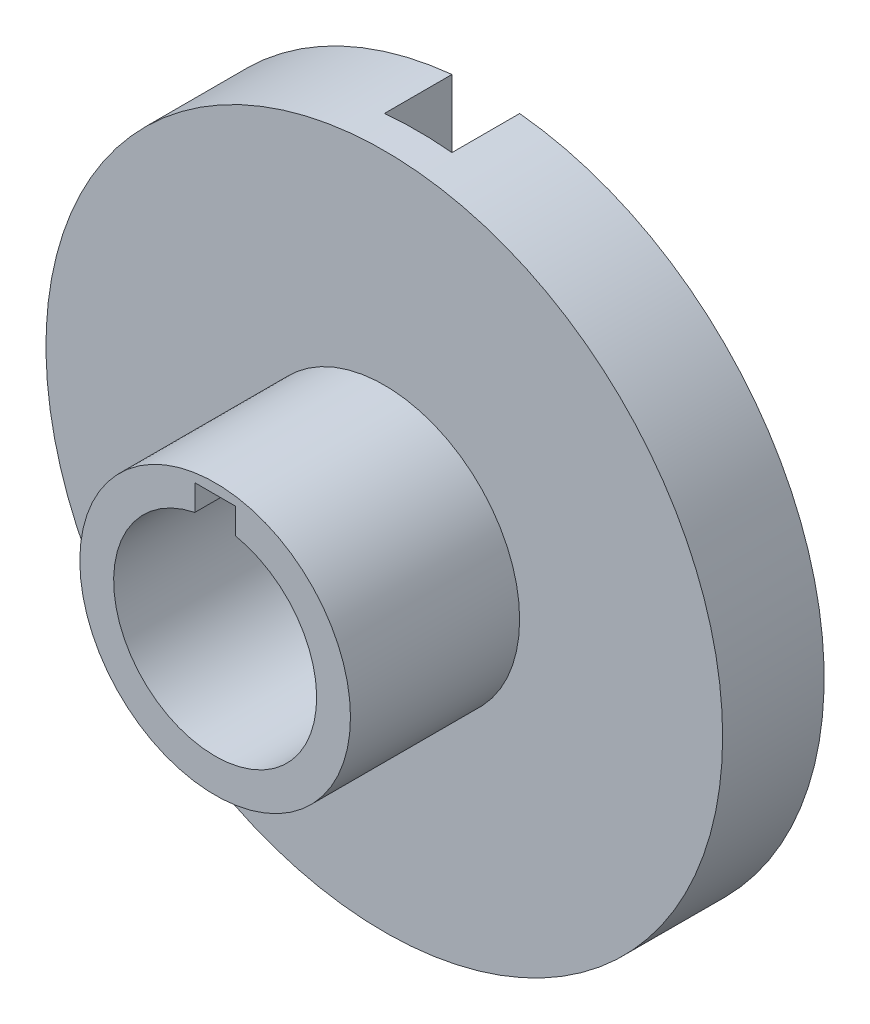
from build123d import *

# Parameters (mm, degrees)
SKETCH1_R               = 50
SKETCH1_R_2             = 20
BOSS_EXTRUDE1_DEPTH     = 15
SKETCH1_3_R             = 20
SKETCH1_3_R_2           = 15
BOSS_EXTRUDE2_DEPTH     = 40
SKETCH2_W               = 6
SKETCH2_H               = 4
CUT_EXTRUDE1_DEPTH      = 80
CUT_EXTRUDE2_DEPTH      = 80
CUT_EXTRUDE2_DEPTH_BACK = 80
SKETCH3_W               = 10
SKETCH3_H               = 10


with BuildPart() as part:
    # Sketch1 → Boss-Extrude1 (new body)
    with BuildSketch(Plane.XY):
        Circle(SKETCH1_R)
        Circle(SKETCH1_R_2, mode=Mode.SUBTRACT)
    extrude(amount=BOSS_EXTRUDE1_DEPTH)

    # Sketch1<3> → Boss-Extrude2 (add)
    with BuildSketch(Plane.XY):
        Circle(SKETCH1_3_R)
        Circle(SKETCH1_3_R_2, mode=Mode.SUBTRACT)
    extrude(amount=BOSS_EXTRUDE2_DEPTH)

    # Sketch2 → Cut-Extrude1 (cut)
    with BuildSketch(Plane.XY):
        with Locations((0, 16.5)):
            Rectangle(SKETCH2_W, SKETCH2_H)
    extrude(amount=CUT_EXTRUDE1_DEPTH, mode=Mode.SUBTRACT)

    # Sketch3 → Cut-Extrude2 (cut, two sides: drawn at the far end of the back side and taken through both)
    with BuildSketch(Plane(origin=(0, 0, 0), x_dir=(1, 0, 0), z_dir=(0, 1, 0)).offset(-CUT_EXTRUDE2_DEPTH_BACK)):
        with Locations((0, -5)):
            Rectangle(SKETCH3_W, SKETCH3_H)
    extrude(amount=CUT_EXTRUDE2_DEPTH + CUT_EXTRUDE2_DEPTH_BACK, mode=Mode.SUBTRACT)


solid = part.part
